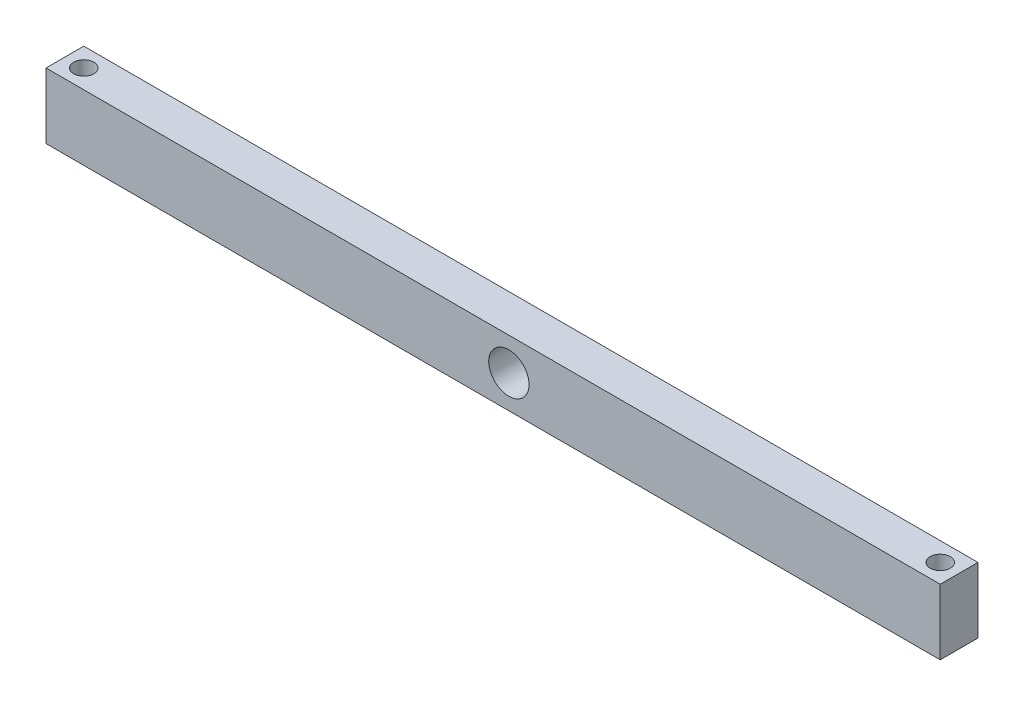
from build123d import *

# Parameters (mm, degrees)
SKETCH1_W           = 71
SKETCH1_H           = 3
BOSS_EXTRUDE1_DEPTH = 5.2
SKETCH2_R           = 0.8
CUT_EXTRUDE1_DEPTH  = 5.2
SKETCH3_R           = 1.6
CUT_EXTRUDE2_DEPTH  = 5.2


with BuildPart() as part:
    # Sketch1 → Boss-Extrude1 (new body)
    with BuildSketch(Plane(origin=(0, 0, 0), x_dir=(1, 0, 0), z_dir=(0, 1, 0))):
        with Locations((-19.414749289, -18.085343374)):
            Rectangle(SKETCH1_W, SKETCH1_H)
    extrude(amount=BOSS_EXTRUDE1_DEPTH)

    # Sketch2 → Cut-Extrude1 (cut)
    with BuildSketch(Plane(origin=(0, 5.2, 0), x_dir=(1, 0, 0), z_dir=(0, 1, 0))):
        with Locations(Location((-53.414749289, -18.085343374, 0), (0, 0, 270))):
            Circle(SKETCH2_R)
        with Locations(Location((14.585250711, -18.085343374, 0), (0, 0, 270))):
            Circle(SKETCH2_R)
    extrude(amount=-CUT_EXTRUDE1_DEPTH, mode=Mode.SUBTRACT)

    # Sketch3 → Cut-Extrude2 (cut)
    with BuildSketch(Plane(origin=(0, 0, 16.585343374), x_dir=(-1, 0, 0), z_dir=(0, 0, -1))):
        with Locations((18.164749289, 2.6)):
            Circle(SKETCH3_R)
    extrude(amount=-CUT_EXTRUDE2_DEPTH, mode=Mode.SUBTRACT)


solid = part.part
